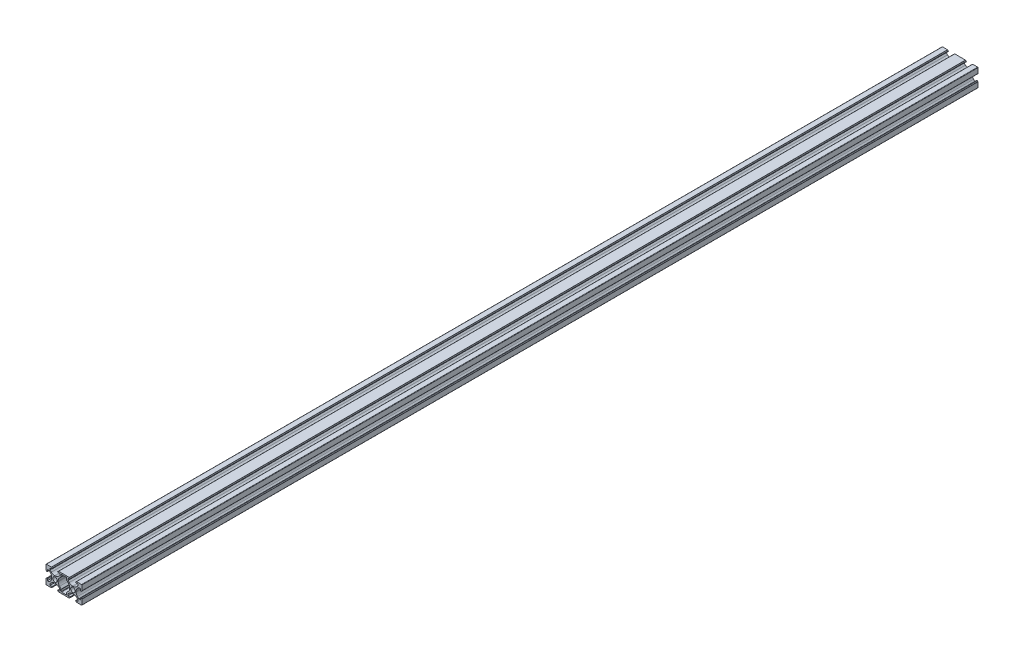
from build123d import *

# Parameters (mm, degrees)
RESSALTO_EXTRUS_O1_DEPTH    = 1000
PADR_OCIRCULAR1_COUNT       = 4
PADR_O_LINEAR1_COUNT        = 2
PADR_O_LINEAR1_PITCH        = 20
PADR_O_LINEAR1_COPY_1_DEPTH = 1000
PADR_O_LINEAR1_COPY_2_DEPTH = 1000
PADR_O_LINEAR1_COPY_3_DEPTH = 1000
CORTE_EXTRUS_O1_DEPTH       = 1001.499875062
FILETE1_R                   = 0.4
FILETE2_R                   = 0.4


with BuildPart() as part:
    # Esboço1 → Ressalto-extrusão1 (new body)
    with BuildSketch(Plane.XY):
        with BuildLine():
            ThreePointArc((-9.317157288, 3.217157288), (-9.187387948, 3.130448187), (-9.034314575, 3.1))
            Line((-9.034314575, 3.1), (-8.9, 3.1))
            ThreePointArc((-8.9, 3.1), (-8.617157288, 3.217157288), (-8.5, 3.5))
            Line((-8.5, 3.5), (-8.5, 5.5))
            Line((-8.5, 5.5), (-6.560660172, 5.5))
            Line((-6.560660172, 5.5), (-5.064466094, 4.003805922))
            ThreePointArc((-5.064466094, 4.003805922), (-3.980602337, 2.381689178), (-3.6, 0.468272016))
            Line((-3.6, 0.468272016), (-3.6, 0))
            Line((-3.6, 0), (-2.5, 0))
            ThreePointArc((-2.5, 0), (-1.767766953, 1.767766953), (0, 2.5))
            Line((0, 2.5), (0, 3.6))
            Line((0, 3.6), (-0.468272016, 3.6))
            ThreePointArc((-0.468272016, 3.6), (-2.381689178, 3.980602337), (-4.003805922, 5.064466094))
            Line((-4.003805922, 5.064466094), (-5.5, 6.560660172))
            Line((-5.5, 6.560660172), (-5.5, 8.5))
            Line((-5.5, 8.5), (-3.5, 8.5))
            ThreePointArc((-3.5, 8.5), (-3.217157288, 8.617157288), (-3.1, 8.9))
            Line((-3.1, 8.9), (-3.1, 9.034314575))
            ThreePointArc((-3.1, 9.034314575), (-3.130448187, 9.187387948), (-3.217157288, 9.317157288))
            Line((-3.217157288, 9.317157288), (-3.782842712, 9.882842712))
            ThreePointArc((-3.782842712, 9.882842712), (-3.912612052, 9.969551813), (-4.065685425, 10))
            Line((-4.065685425, 10), (-10, 10))
            Line((-10, 10), (-10, 4.065685425))
            ThreePointArc((-10, 4.065685425), (-9.969551813, 3.912612052), (-9.882842712, 3.782842712))
            Line((-9.882842712, 3.782842712), (-9.317157288, 3.217157288))
        make_face()
    ressalto_extrus_o1 = extrude(amount=RESSALTO_EXTRUS_O1_DEPTH)

    # PadrãoCircular1: Ressalto-extrusão1 ×4 about axis
    padr_ocircular1_axis = Axis((0, 0, 0), (0, 0, 1))
    for i in range(1, PADR_OCIRCULAR1_COUNT):
        add(ressalto_extrus_o1.rotate(padr_ocircular1_axis, i * 360 / PADR_OCIRCULAR1_COUNT))

    # Padrão linear1: Ressalto-extrusão1 ×2
    with Locations(*[(i * PADR_O_LINEAR1_PITCH, 0, 0) for i in range(1, PADR_O_LINEAR1_COUNT)]):
        add(ressalto_extrus_o1)

    # Padrão linear1 copy 1 sketch → Padrão linear1 copy 1 (add)
    with BuildSketch(Plane(origin=(20, 0, 0), x_dir=(0, 1, 0), z_dir=(0, 0, 1))):
        with BuildLine():
            ThreePointArc((-9.317157288, 3.217157288), (-9.187387948, 3.130448187), (-9.034314575, 3.1))
            Line((-9.034314575, 3.1), (-8.9, 3.1))
            ThreePointArc((-8.9, 3.1), (-8.617157288, 3.217157288), (-8.5, 3.5))
            Line((-8.5, 3.5), (-8.5, 5.5))
            Line((-8.5, 5.5), (-6.560660172, 5.5))
            Line((-6.560660172, 5.5), (-5.064466094, 4.003805922))
            ThreePointArc((-5.064466094, 4.003805922), (-3.980602337, 2.381689178), (-3.6, 0.468272016))
            Line((-3.6, 0.468272016), (-3.6, 0))
            Line((-3.6, 0), (-2.5, 0))
            ThreePointArc((-2.5, 0), (-1.767766953, 1.767766953), (0, 2.5))
            Line((0, 2.5), (0, 3.6))
            Line((0, 3.6), (-0.468272016, 3.6))
            ThreePointArc((-0.468272016, 3.6), (-2.381689178, 3.980602337), (-4.003805922, 5.064466094))
            Line((-4.003805922, 5.064466094), (-5.5, 6.560660172))
            Line((-5.5, 6.560660172), (-5.5, 8.5))
            Line((-5.5, 8.5), (-3.5, 8.5))
            ThreePointArc((-3.5, 8.5), (-3.217157288, 8.617157288), (-3.1, 8.9))
            Line((-3.1, 8.9), (-3.1, 9.034314575))
            ThreePointArc((-3.1, 9.034314575), (-3.130448187, 9.187387948), (-3.217157288, 9.317157288))
            Line((-3.217157288, 9.317157288), (-3.782842712, 9.882842712))
            ThreePointArc((-3.782842712, 9.882842712), (-3.912612052, 9.969551813), (-4.065685425, 10))
            Line((-4.065685425, 10), (-10, 10))
            Line((-10, 10), (-10, 4.065685425))
            ThreePointArc((-10, 4.065685425), (-9.969551813, 3.912612052), (-9.882842712, 3.782842712))
            Line((-9.882842712, 3.782842712), (-9.317157288, 3.217157288))
        make_face()
    extrude(amount=PADR_O_LINEAR1_COPY_1_DEPTH)

    # Padrão linear1 copy 2 sketch → Padrão linear1 copy 2 (add)
    with BuildSketch(Plane(origin=(20, 0, 0), x_dir=(-1, 0, 0), z_dir=(0, 0, 1))):
        with BuildLine():
            ThreePointArc((-9.317157288, 3.217157288), (-9.187387948, 3.130448187), (-9.034314575, 3.1))
            Line((-9.034314575, 3.1), (-8.9, 3.1))
            ThreePointArc((-8.9, 3.1), (-8.617157288, 3.217157288), (-8.5, 3.5))
            Line((-8.5, 3.5), (-8.5, 5.5))
            Line((-8.5, 5.5), (-6.560660172, 5.5))
            Line((-6.560660172, 5.5), (-5.064466094, 4.003805922))
            ThreePointArc((-5.064466094, 4.003805922), (-3.980602337, 2.381689178), (-3.6, 0.468272016))
            Line((-3.6, 0.468272016), (-3.6, 0))
            Line((-3.6, 0), (-2.5, 0))
            ThreePointArc((-2.5, 0), (-1.767766953, 1.767766953), (0, 2.5))
            Line((0, 2.5), (0, 3.6))
            Line((0, 3.6), (-0.468272016, 3.6))
            ThreePointArc((-0.468272016, 3.6), (-2.381689178, 3.980602337), (-4.003805922, 5.064466094))
            Line((-4.003805922, 5.064466094), (-5.5, 6.560660172))
            Line((-5.5, 6.560660172), (-5.5, 8.5))
            Line((-5.5, 8.5), (-3.5, 8.5))
            ThreePointArc((-3.5, 8.5), (-3.217157288, 8.617157288), (-3.1, 8.9))
            Line((-3.1, 8.9), (-3.1, 9.034314575))
            ThreePointArc((-3.1, 9.034314575), (-3.130448187, 9.187387948), (-3.217157288, 9.317157288))
            Line((-3.217157288, 9.317157288), (-3.782842712, 9.882842712))
            ThreePointArc((-3.782842712, 9.882842712), (-3.912612052, 9.969551813), (-4.065685425, 10))
            Line((-4.065685425, 10), (-10, 10))
            Line((-10, 10), (-10, 4.065685425))
            ThreePointArc((-10, 4.065685425), (-9.969551813, 3.912612052), (-9.882842712, 3.782842712))
            Line((-9.882842712, 3.782842712), (-9.317157288, 3.217157288))
        make_face()
    extrude(amount=PADR_O_LINEAR1_COPY_2_DEPTH)

    # Padrão linear1 copy 3 sketch → Padrão linear1 copy 3 (add)
    with BuildSketch(Plane(origin=(20, 0, 0), x_dir=(0, -1, 0), z_dir=(0, 0, 1))):
        with BuildLine():
            ThreePointArc((-9.317157288, 3.217157288), (-9.187387948, 3.130448187), (-9.034314575, 3.1))
            Line((-9.034314575, 3.1), (-8.9, 3.1))
            ThreePointArc((-8.9, 3.1), (-8.617157288, 3.217157288), (-8.5, 3.5))
            Line((-8.5, 3.5), (-8.5, 5.5))
            Line((-8.5, 5.5), (-6.560660172, 5.5))
            Line((-6.560660172, 5.5), (-5.064466094, 4.003805922))
            ThreePointArc((-5.064466094, 4.003805922), (-3.980602337, 2.381689178), (-3.6, 0.468272016))
            Line((-3.6, 0.468272016), (-3.6, 0))
            Line((-3.6, 0), (-2.5, 0))
            ThreePointArc((-2.5, 0), (-1.767766953, 1.767766953), (0, 2.5))
            Line((0, 2.5), (0, 3.6))
            Line((0, 3.6), (-0.468272016, 3.6))
            ThreePointArc((-0.468272016, 3.6), (-2.381689178, 3.980602337), (-4.003805922, 5.064466094))
            Line((-4.003805922, 5.064466094), (-5.5, 6.560660172))
            Line((-5.5, 6.560660172), (-5.5, 8.5))
            Line((-5.5, 8.5), (-3.5, 8.5))
            ThreePointArc((-3.5, 8.5), (-3.217157288, 8.617157288), (-3.1, 8.9))
            Line((-3.1, 8.9), (-3.1, 9.034314575))
            ThreePointArc((-3.1, 9.034314575), (-3.130448187, 9.187387948), (-3.217157288, 9.317157288))
            Line((-3.217157288, 9.317157288), (-3.782842712, 9.882842712))
            ThreePointArc((-3.782842712, 9.882842712), (-3.912612052, 9.969551813), (-4.065685425, 10))
            Line((-4.065685425, 10), (-10, 10))
            Line((-10, 10), (-10, 4.065685425))
            ThreePointArc((-10, 4.065685425), (-9.969551813, 3.912612052), (-9.882842712, 3.782842712))
            Line((-9.882842712, 3.782842712), (-9.317157288, 3.217157288))
        make_face()
    extrude(amount=PADR_O_LINEAR1_COPY_3_DEPTH)

    # Esboço4 → Corte-extrusão1 (cut, through all)
    with BuildSketch(Plane(origin=(0, 0, 0), x_dir=(-1, 0, 0), z_dir=(0, 0, -1))):
        Polygon((-13.439339828, 5.5), (-13, 5.939339828), (-13, 8.5), (-7, 8.5), (-7, 5.939339828), (-6.560660172, 5.5), (-6.560660172, -5.5), (-7, -5.939339828), (-7, -8.5), (-13, -8.5), (-13, -5.939339828), (-13.439339828, -5.5), align=None)
    extrude(amount=-CORTE_EXTRUS_O1_DEPTH, mode=Mode.SUBTRACT)

    # Filete1
    filete1_edges = [part.edges().sort_by_distance(p)[0] for p in [
        (13, 5.939339828, 500),
        (13, 8.5, 500),
        (7, 8.5, 500),
        (7, 5.939339828, 500),
        (7, -5.939339828, 500),
        (7, -8.5, 500),
        (13, -8.5, 500),
        (13, -5.939339828, 500),
    ]]
    fillet(filete1_edges, radius=FILETE1_R)

    # Filete2
    filete2_edges = [part.edges().sort_by_distance(p)[0] for p in [
        (30, -10, 500),
        (30, 10, 500),
        (-10, 10, 500),
        (-10, -10, 500),
    ]]
    fillet(filete2_edges, radius=FILETE2_R)


solid = part.part
